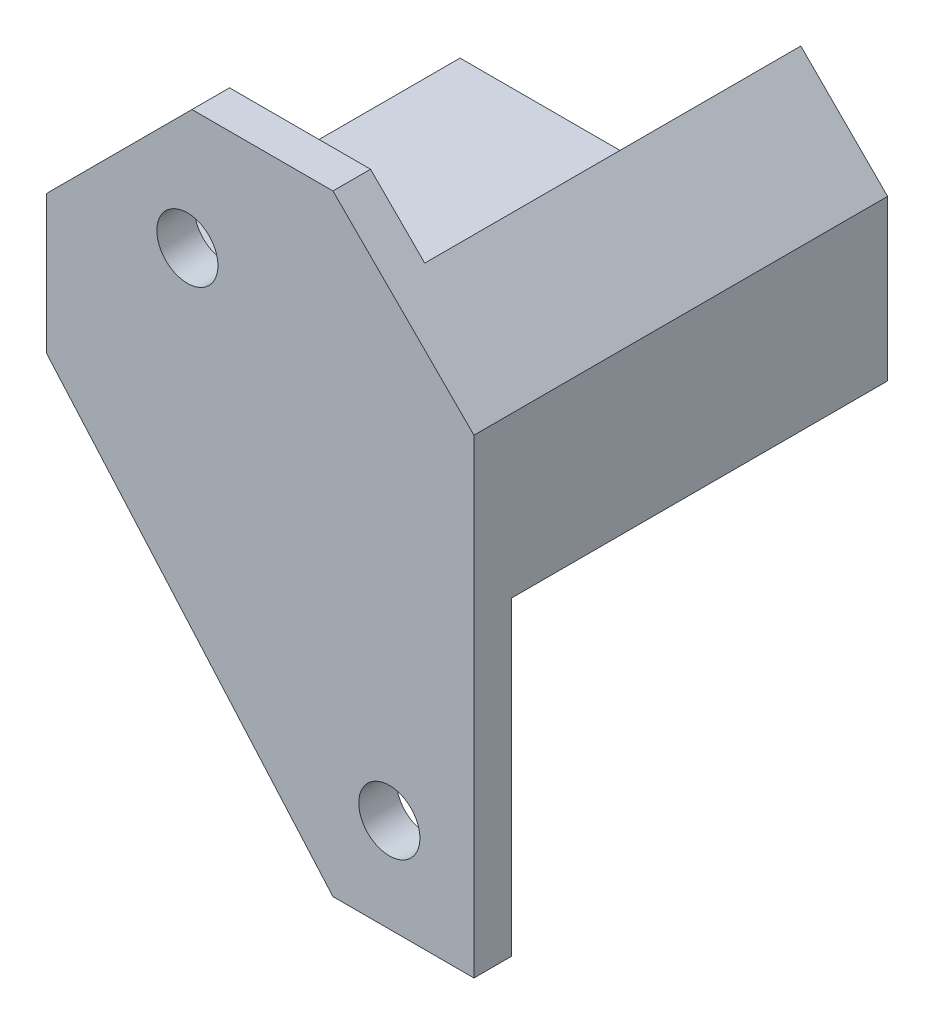
from build123d import *

# Parameters (mm, degrees)
BOSS_EXTRUDE4_DEPTH = 4
BOSS_EXTRUDE5_DEPTH = 40
CHAMFER2_SIZE       = 20
CHAMFER3_SIZE       = 18
CHAMFER4_SIZE       = 15
SKETCH9_R           = 4.2
CUT_EXTRUDE3_DEPTH  = 30
CUT_EXTRUDE5_DEPTH  = 5
CUT_EXTRUDE6_DEPTH  = 5
CUT_EXTRUDE7_DEPTH  = 40
CUT_EXTRUDE8_REACH  = 73.867
SKETCH15_W          = 8.348640977
SKETCH15_H          = 16.947088632
SKETCH16_R          = 3.25
CUT_EXTRUDE9_DEPTH  = 70.490380964


with BuildPart() as part:
    # Sketch6 → Boss-Extrude4 (new body)
    with BuildSketch(Plane.XY):
        Polygon((-13.841173909, 21.165626019), (36.158826091, 21.165626019), (36.158826091, -43.834373981), (21.158826091, -43.834373981), (-13.841173909, -3.834373981), align=None)
    extrude(amount=BOSS_EXTRUDE4_DEPTH)

    # Sketch8 → Boss-Extrude5 (add)
    with BuildSketch(Plane(origin=(0, 0, 0), x_dir=(-1, 0, 0), z_dir=(0, 0, -1))):
        Polygon((13.841173909, -3.834373981), (13.841173909, 21.165626019), (-36.158826091, 21.165626019), (-36.158826091, -28.834373981), (-8.033826091, -28.834373981), align=None)
    extrude(amount=BOSS_EXTRUDE5_DEPTH)

    # Chamfer2
    chamfer2_edges = [part.edges().sort_by_distance(p)[0] for p in [
        (-13.841173909, 21.165626019, -18),
    ]]
    chamfer(chamfer2_edges, length=CHAMFER2_SIZE)

    # Chamfer3
    chamfer3_edges = [part.edges().sort_by_distance(p)[0] for p in [
        (36.158826091, -28.834373981, -20),
    ]]
    chamfer(chamfer3_edges, length=CHAMFER3_SIZE)

    # Chamfer4
    chamfer4_edges = [part.edges().sort_by_distance(p)[0] for p in [
        (36.158826091, 21.165626019, -18),
    ]]
    chamfer(chamfer4_edges, length=CHAMFER4_SIZE)

    # Sketch9 → Cut-Extrude3 (cut)
    with BuildSketch(Plane.ZY.offset(13.841173909)):
        with Locations((-26, -16.001319659)):
            Circle(SKETCH9_R)
    extrude(amount=-CUT_EXTRUDE3_DEPTH, mode=Mode.SUBTRACT)

    # Sketch12 → Cut-Extrude5 (cut)
    with BuildSketch(Plane(origin=(0, 0, -40), x_dir=(-1, 0, 0), z_dir=(0, 0, -1))):
        Polygon((-10.158826091, -12.98463172), (-14.358826091, -15.40950285), (-14.358826091, -20.259245112), (-10.158826091, -22.684116242), (-5.958826091, -20.259245112), (-5.958826091, -15.40950285), align=None)
    extrude(amount=-CUT_EXTRUDE5_DEPTH, mode=Mode.SUBTRACT)

    # Sketch13 → Cut-Extrude6 (cut)
    with BuildSketch(Plane(origin=(0, 0, -40), x_dir=(-1, 0, 0), z_dir=(0, 0, -1))):
        Polygon((-26.158826091, 2.01536828), (-30.358826091, -0.40950285), (-30.358826091, -5.259245112), (-26.158826091, -7.684116242), (-21.958826091, -5.259245112), (-21.958826091, -0.40950285), align=None)
    extrude(amount=-CUT_EXTRUDE6_DEPTH, mode=Mode.SUBTRACT)

    # Sketch14 → Cut-Extrude7 (cut)
    with BuildSketch(Plane(origin=(0, 0, -40), x_dir=(-1, 0, 0), z_dir=(0, 0, -1))):
        Polygon((-26.924663751, 15.399788359), (-7.69050141, -3.834373981), (13.841173909, -3.834373981), (13.841173909, 21.165626019), (-21.158826091, 21.165626019), align=None)
    extrude(amount=-CUT_EXTRUDE7_DEPTH, mode=Mode.SUBTRACT)

    # Cut-Extrude8: up to this face of the body (flat: up to its plane)
    cut_extrude8_end = Plane(part.part.faces().sort_by_distance((15.963295364, -9.029904707, 4))[0])
    # Sketch15 → Cut-Extrude8 (cut, up to the picked face)
    with BuildSketch(Plane(origin=(0, 0, -40), x_dir=(-1, 0, 0), z_dir=(0, 0, -1)), mode=Mode.PRIVATE) as cut_extrude8_sk1:
        with Locations((13.494862379, -1.621142496)):
            Rectangle(SKETCH15_W, SKETCH15_H)
    cut_extrude8_tool1 = split(extrude(cut_extrude8_sk1.sketch, amount=-CUT_EXTRUDE8_REACH, mode=Mode.PRIVATE), bisect_by=cut_extrude8_end, keep=Keep.BOTH, mode=Mode.PRIVATE)
    add(cut_extrude8_tool1.solids().sort_by(Axis((-13.494862, -1.621142, -40), (0, 0, 1)))[0], mode=Mode.SUBTRACT)

    # Sketch16 → Cut-Extrude9 (cut, through all)
    with BuildSketch(Plane(origin=(0, 0, 0), x_dir=(-1, 0, 0), z_dir=(0, 0, -1))):
        with Locations((-27.158826091, -33.834373981)):
            Circle(SKETCH16_R)
        with Locations((-5.67945811, 8.165626019)):
            Circle(SKETCH16_R)
    extrude(amount=-CUT_EXTRUDE9_DEPTH, mode=Mode.SUBTRACT)


solid = part.part
